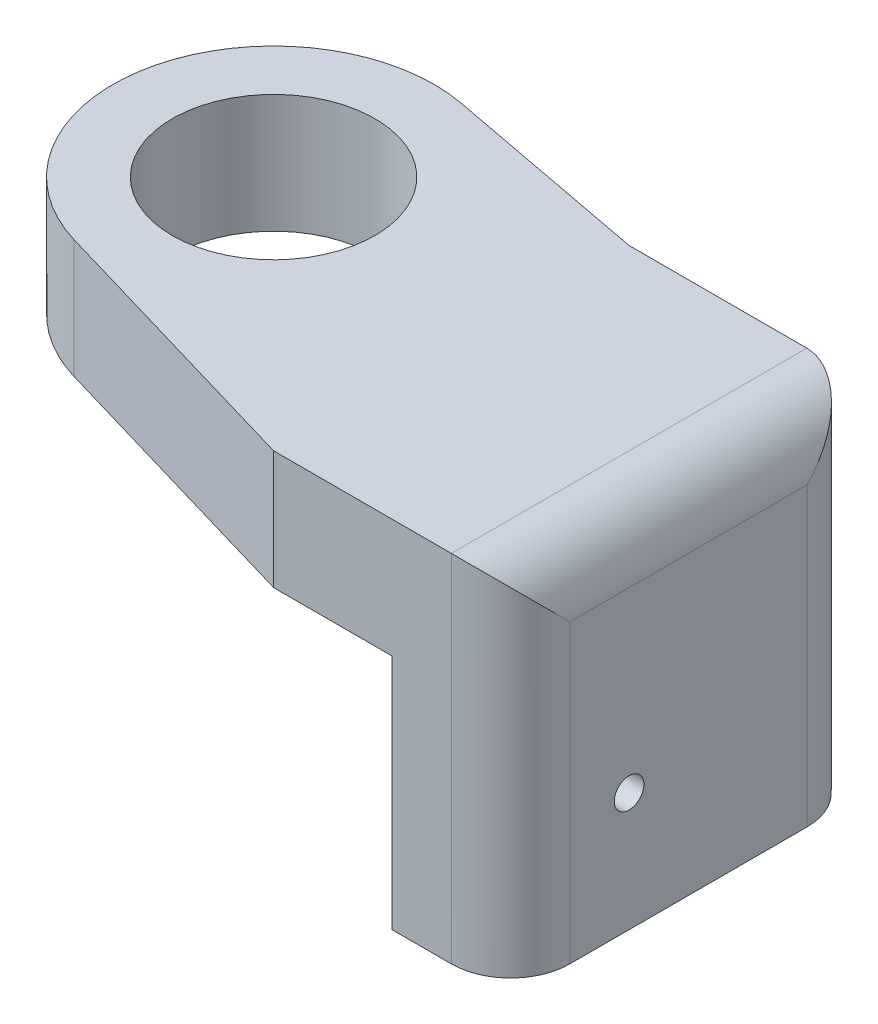
from build123d import *

# Parameters (mm, degrees)
SKETCH1_W           = 20
SKETCH1_H           = 30
BOSS_EXTRUDE1_DEPTH = 10
BOSS_EXTRUDE2_DEPTH = 10
SKETCH4_R           = 8.55
BOSS_EXTRUDE3_DEPTH = 10
CUT_EXTRUDE1_DEPTH  = 10
BOSS_EXTRUDE4_DEPTH = 10
SKETCH7_R           = 1.25
CUT_EXTRUDE2_DEPTH  = 10
FILLET1_R           = 5


with BuildPart() as part:
    # Sketch1 → Boss-Extrude1 (new body)
    with BuildSketch(Plane(origin=(0, 0, 0), x_dir=(1, 0, 0), z_dir=(0, 1, 0))):
        with Locations((10, -15)):
            Rectangle(SKETCH1_W, SKETCH1_H)
    extrude(amount=BOSS_EXTRUDE1_DEPTH)

    # Sketch2 → Boss-Extrude2 (add)
    with BuildSketch(Plane(origin=(0, 10, 0), x_dir=(1, 0, 0), z_dir=(0, 1, 0))):
        Polygon((0, 0), (0, -10), (10, -10), (10, -30), (20, -30), (20, 0), align=None)
    boss_extrude2 = extrude(amount=BOSS_EXTRUDE2_DEPTH)

    # Sketch4 → Boss-Extrude3 (add)
    with BuildSketch(Plane(origin=(0, 10, 0), x_dir=(1, 0, 0), z_dir=(0, 1, 0))):
        with BuildLine():
            Line((0, 0), (-17.51372228, 3.319944561))
            ThreePointArc((-17.51372228, 3.319944561), (-33.173842638, -6.829452704), (-23.846362702, -22.992613054))
            Line((-23.846362702, -22.992613054), (0, -30))
            Line((0, -30), (0, 0))
        make_face()
        with Locations(Location((-20, -10, 0), (0, 0, 270))):
            Circle(SKETCH4_R, mode=Mode.SUBTRACT)
    extrude(amount=-BOSS_EXTRUDE3_DEPTH)

    # Mirror1: Boss-Extrude2 across plane
    add(boss_extrude2.mirror(Plane(origin=(0, 5, 0), x_dir=(0, 0, 1), z_dir=(0, -1, 0))))

    # Sketch5 → Cut-Extrude1 (cut)
    with BuildSketch(Plane(origin=(0, 20, 0), x_dir=(1, 0, 0), z_dir=(0, 1, 0))):
        Polygon((20, 0), (0, 0), (0, -10), (10, -10), (10, -30), (20, -30), align=None)
    extrude(amount=-CUT_EXTRUDE1_DEPTH, mode=Mode.SUBTRACT)

    # Sketch6 → Boss-Extrude4 (add)
    with BuildSketch(Plane.XZ.offset(10)):
        Polygon((0, 0), (20, 0), (20, 30), (10, 30), (10, 10), (0, 10), align=None)
    extrude(amount=BOSS_EXTRUDE4_DEPTH)

    # Sketch7 → Cut-Extrude2 (cut)
    with BuildSketch(Plane.ZY.offset(-10)):
        with Locations((20, -10)):
            Circle(SKETCH7_R)
    extrude(amount=-CUT_EXTRUDE2_DEPTH, mode=Mode.SUBTRACT)

    # Fillet1
    fillet1_edges = [part.edges().sort_by_distance(p)[0] for p in [
        (20, -5, 0),
        (20, -5, 30),
        (20, 10, 15),
    ]]
    fillet(fillet1_edges, radius=FILLET1_R)


solid = part.part
